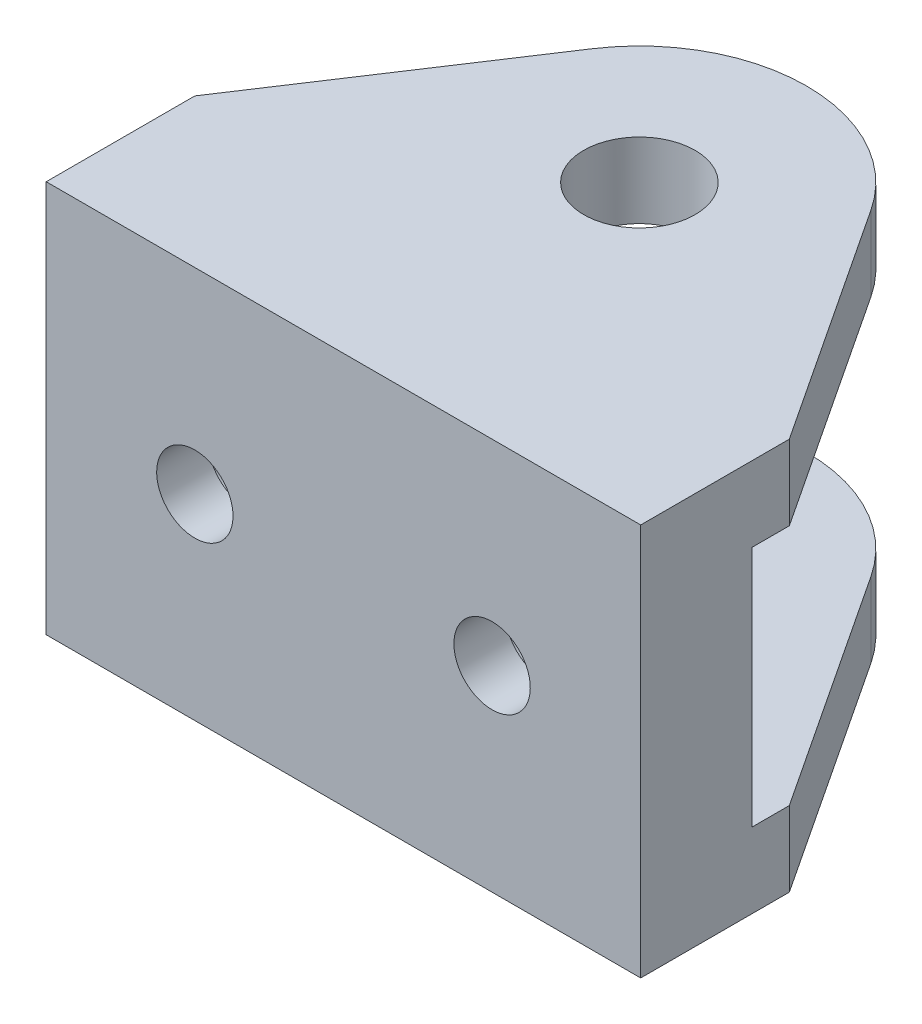
from build123d import *

# Parameters (mm, degrees)
BOSS_EXTRUDE1_DEPTH         = 50.8
SKETCH2_R                   = 3.2639
F_1_4_CLEARNACE_HOLES_DEPTH = 9.4996
CUT_EXTRUDE2_REACH          = 75.836
SKETCH3_R                   = 4.7625
SKETCH4_R                   = 4.7625
F_3_8_HEAD_DEPTH            = 5.08


with BuildPart() as part:
    # Sketch1 → Boss-Extrude1 (new body)
    with BuildSketch(Plane(origin=(0, 0, 0), x_dir=(0, 0, -1), z_dir=(1, 0, 0))):
        Polygon((41.796907359, 27.1145), (9.4996, 27.1145), (9.4996, 6.4135), (41.796907359, 6.4135), (41.796907359, 0), (0, 0), (0, 33.528), (41.796907359, 33.528), align=None)
    extrude(amount=BOSS_EXTRUDE1_DEPTH)

    # Sketch2 → 1/4 Clearnace Holes (cut)
    with BuildSketch(Plane(origin=(0, 0, -9.4996), x_dir=(-1, 0, 0), z_dir=(0, 0, -1))):
        with Locations(Location((-38.1, 16.764, 0), (0, 0, 90))):
            Circle(SKETCH2_R)
        with Locations(Location((-12.7, 16.764, 0), (0, 0, 90))):
            Circle(SKETCH2_R)
    extrude(amount=-F_1_4_CLEARNACE_HOLES_DEPTH, mode=Mode.SUBTRACT)

    # Cut-Extrude2: up to this face of the body (flat: up to its plane)
    cut_extrude2_end = Plane(part.part.faces().sort_by_distance((25.4, 33.528, -20.898453679))[0])
    # Sketch3 → Cut-Extrude2 (cut, up to the picked face)
    with BuildSketch(Plane.XZ, mode=Mode.PRIVATE) as cut_extrude2_sk1:
        with Locations(Location((25.4, -25.286907359, 0), (0, 0, 270))):
            Circle(SKETCH3_R)
    cut_extrude2_tool1 = split(extrude(cut_extrude2_sk1.sketch, amount=-CUT_EXTRUDE2_REACH, mode=Mode.PRIVATE), bisect_by=cut_extrude2_end, keep=Keep.BOTH, mode=Mode.PRIVATE)
    # Sketch3 → Cut-Extrude2 (cut, up to the picked face)
    with BuildSketch(Plane.XZ, mode=Mode.PRIVATE) as cut_extrude2_sk2:
        with BuildLine():
            Line((0, -12.7), (13.468510474, -33.146437494))
            ThreePointArc((13.468510474, -33.146437494), (25.4, -39.574407359), (37.331489526, -33.146437494))
            Line((37.331489526, -33.146437494), (50.8, -12.7))
            Line((50.8, -12.7), (50.8, -41.796907359))
            Line((50.8, -41.796907359), (0, -41.796907359))
            Line((0, -41.796907359), (0, -12.7))
        make_face()
    cut_extrude2_tool2 = split(extrude(cut_extrude2_sk2.sketch, amount=-CUT_EXTRUDE2_REACH, mode=Mode.PRIVATE), bisect_by=cut_extrude2_end, keep=Keep.BOTH, mode=Mode.PRIVATE)
    add(cut_extrude2_tool1.solids().sort_by(Axis((25.4, 0, -25.286907), (0, 1, 0)))[0], mode=Mode.SUBTRACT)
    add(cut_extrude2_tool2.solids().sort_by(Axis((6.245364, 0, -23.245262), (0, 1, 0)))[0], mode=Mode.SUBTRACT)

    # Sketch4 → 3/8 Head (cut)
    with BuildSketch(Plane(origin=(0, 0, -9.4996), x_dir=(-1, 0, 0), z_dir=(0, 0, -1))):
        with Locations(Location((-12.7, 16.764, 0), (0, 0, 90))):
            Circle(SKETCH4_R)
        with Locations(Location((-38.1, 16.764, 0), (0, 0, 90))):
            Circle(SKETCH4_R)
    extrude(amount=-F_3_8_HEAD_DEPTH, mode=Mode.SUBTRACT)


solid = part.part
